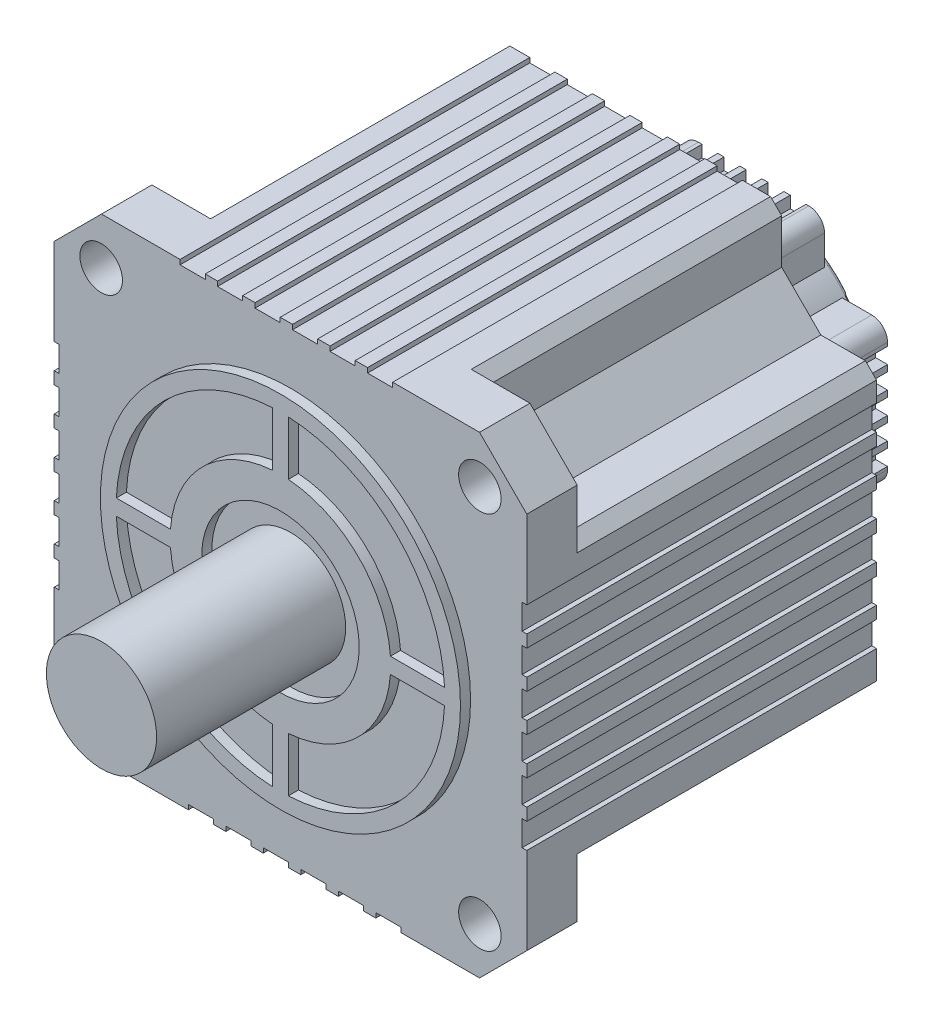
from build123d import *
from build123d.topology import SkipClean

# Parameters (mm, degrees)
EXTRUDE_1_DEPTH                     = 16
SKETCH_5_R                          = 57.15
EXTRUDE_2_DEPTH                     = 3.2
SKETCH_6_R                          = 52.15
CUT_EXTRUDE_3_DEPTH                 = 3.2
SKETCH_7_R                          = 17.5
EXTRUDE_4_DEPTH                     = 60
SKETCH_9_W                          = 29.28796894
SKETCH_9_H                          = 5
EXTRUDE_5_DEPTH                     = 3.2
PATTERN_CIRCULAR_1_COUNT            = 4
SKETCH_10_R                         = 35
SKETCH_10_R_2                       = 25
EXTRUDE_6_DEPTH                     = 3.2
EXTRUDE_7_DEPTH                     = 95
EXTRUDE_8_DEPTH                     = 36
SKETCH_13_R                         = 36.003209025
EXTRUDE_9_DEPTH                     = 2
FILLET_5_R                          = 1
SKETCH_14_W                         = 8
SKETCH_14_H                         = 13.851219487
CUT_EXTRUDE_10_DEPTH                = 120
SKETCH_15_W                         = 5
SKETCH_15_H                         = 4.986387051
CUT_EXTRUDE_11_DEPTH                = 44
PATTERN_LINEAR_4_COUNT              = 5
PATTERN_LINEAR_4_PITCH              = 7
EXTRUDE_12_DEPTH                    = 2
SKETCH_16_3_R                       = 1.5
EXTRUDE_13_DEPTH                    = 2
PATTERN_LINEAR_3_COUNT              = 6
PATTERN_LINEAR_3_PITCH              = 11.9
PATTERN_CIRCULAR_2_COUNT            = 4
PATTERN_CIRCULAR_2_COPY_1_SKETCH_W  = 8
PATTERN_CIRCULAR_2_COPY_1_SKETCH_H  = 13.851219487
PATTERN_CIRCULAR_2_COPY_1_DEPTH     = 120
PATTERN_CIRCULAR_2_COPY_2_SKETCH_W  = 8
PATTERN_CIRCULAR_2_COPY_2_SKETCH_H  = 13.851219487
PATTERN_CIRCULAR_2_COPY_2_DEPTH     = 120
PATTERN_CIRCULAR_2_COPY_3_SKETCH_W  = 8
PATTERN_CIRCULAR_2_COPY_3_SKETCH_H  = 13.851219487
PATTERN_CIRCULAR_2_COPY_3_DEPTH     = 120
PATTERN_CIRCULAR_2_COPY_4_SKETCH_W  = 8
PATTERN_CIRCULAR_2_COPY_4_SKETCH_H  = 13.851219487
PATTERN_CIRCULAR_2_COPY_4_DEPTH     = 120
PATTERN_CIRCULAR_2_COPY_5_SKETCH_W  = 8
PATTERN_CIRCULAR_2_COPY_5_SKETCH_H  = 13.851219487
PATTERN_CIRCULAR_2_COPY_5_DEPTH     = 120
PATTERN_CIRCULAR_2_COPY_6_SKETCH_W  = 8
PATTERN_CIRCULAR_2_COPY_6_SKETCH_H  = 13.851219487
PATTERN_CIRCULAR_2_COPY_6_DEPTH     = 120
PATTERN_CIRCULAR_2_COPY_7_SKETCH_W  = 8
PATTERN_CIRCULAR_2_COPY_7_SKETCH_H  = 13.851219487
PATTERN_CIRCULAR_2_COPY_7_DEPTH     = 120
PATTERN_CIRCULAR_2_COPY_8_SKETCH_W  = 8
PATTERN_CIRCULAR_2_COPY_8_SKETCH_H  = 13.851219487
PATTERN_CIRCULAR_2_COPY_8_DEPTH     = 120
PATTERN_CIRCULAR_2_COPY_9_SKETCH_W  = 8
PATTERN_CIRCULAR_2_COPY_9_SKETCH_H  = 13.851219487
PATTERN_CIRCULAR_2_COPY_9_DEPTH     = 120
PATTERN_CIRCULAR_2_COPY_10_SKETCH_W = 8
PATTERN_CIRCULAR_2_COPY_10_SKETCH_H = 13.851219487
PATTERN_CIRCULAR_2_COPY_10_DEPTH    = 120
PATTERN_CIRCULAR_2_COPY_11_SKETCH_W = 8
PATTERN_CIRCULAR_2_COPY_11_SKETCH_H = 13.851219487
PATTERN_CIRCULAR_2_COPY_11_DEPTH    = 120
PATTERN_CIRCULAR_2_COPY_12_SKETCH_W = 8
PATTERN_CIRCULAR_2_COPY_12_SKETCH_H = 13.851219487
PATTERN_CIRCULAR_2_COPY_12_DEPTH    = 120
PATTERN_CIRCULAR_2_COPY_13_SKETCH_W = 8
PATTERN_CIRCULAR_2_COPY_13_SKETCH_H = 13.851219487
PATTERN_CIRCULAR_2_COPY_13_DEPTH    = 120
PATTERN_CIRCULAR_2_COPY_14_SKETCH_W = 8
PATTERN_CIRCULAR_2_COPY_14_SKETCH_H = 13.851219487
PATTERN_CIRCULAR_2_COPY_14_DEPTH    = 120
PATTERN_CIRCULAR_2_COPY_15_SKETCH_W = 8
PATTERN_CIRCULAR_2_COPY_15_SKETCH_H = 13.851219487
PATTERN_CIRCULAR_2_COPY_15_DEPTH    = 120
PATTERN_CIRCULAR_3_COUNT            = 4
PATTERN_CIRCULAR_3_COPY_1_SKETCH_W  = 5
PATTERN_CIRCULAR_3_COPY_1_SKETCH_H  = 4.986387051
PATTERN_CIRCULAR_3_COPY_1_DEPTH     = 44
PATTERN_CIRCULAR_3_COPY_2_SKETCH_W  = 5
PATTERN_CIRCULAR_3_COPY_2_SKETCH_H  = 4.986387051
PATTERN_CIRCULAR_3_COPY_2_DEPTH     = 44
PATTERN_CIRCULAR_3_COPY_3_SKETCH_W  = 5
PATTERN_CIRCULAR_3_COPY_3_SKETCH_H  = 4.986387051
PATTERN_CIRCULAR_3_COPY_3_DEPTH     = 44
PATTERN_CIRCULAR_3_COPY_4_SKETCH_W  = 5
PATTERN_CIRCULAR_3_COPY_4_SKETCH_H  = 4.986387051
PATTERN_CIRCULAR_3_COPY_4_DEPTH     = 44
PATTERN_CIRCULAR_3_COPY_5_SKETCH_W  = 5
PATTERN_CIRCULAR_3_COPY_5_SKETCH_H  = 4.986387051
PATTERN_CIRCULAR_3_COPY_5_DEPTH     = 44
PATTERN_CIRCULAR_3_COPY_6_SKETCH_W  = 5
PATTERN_CIRCULAR_3_COPY_6_SKETCH_H  = 4.986387051
PATTERN_CIRCULAR_3_COPY_6_DEPTH     = 44
PATTERN_CIRCULAR_3_COPY_7_SKETCH_W  = 5
PATTERN_CIRCULAR_3_COPY_7_SKETCH_H  = 4.986387051
PATTERN_CIRCULAR_3_COPY_7_DEPTH     = 44
PATTERN_CIRCULAR_3_COPY_8_SKETCH_W  = 5
PATTERN_CIRCULAR_3_COPY_8_SKETCH_H  = 4.986387051
PATTERN_CIRCULAR_3_COPY_8_DEPTH     = 44
PATTERN_CIRCULAR_3_COPY_9_SKETCH_W  = 5
PATTERN_CIRCULAR_3_COPY_9_SKETCH_H  = 4.986387051
PATTERN_CIRCULAR_3_COPY_9_DEPTH     = 44
PATTERN_CIRCULAR_3_COPY_10_SKETCH_W = 5
PATTERN_CIRCULAR_3_COPY_10_SKETCH_H = 4.986387051
PATTERN_CIRCULAR_3_COPY_10_DEPTH    = 44
PATTERN_CIRCULAR_3_COPY_11_SKETCH_W = 5
PATTERN_CIRCULAR_3_COPY_11_SKETCH_H = 4.986387051
PATTERN_CIRCULAR_3_COPY_11_DEPTH    = 44
PATTERN_CIRCULAR_3_COPY_12_SKETCH_W = 5
PATTERN_CIRCULAR_3_COPY_12_SKETCH_H = 4.986387051
PATTERN_CIRCULAR_3_COPY_12_DEPTH    = 44
SKETCH_17_R                         = 6.75
CUT_EXTRUDE_15_DEPTH                = 30


with BuildPart() as part:
    # 草图1 → 拉伸1 (new body)
    with BuildSketch(Plane.XY):
        Polygon((-60, 75), (-75, 60), (-75, -60), (-60, -75), (60, -75), (75, -60), (75, 60), (60, 75), align=None)
    extrude(amount=EXTRUDE_1_DEPTH)

    # 草图5 → 拉伸2 (add)
    with BuildSketch(Plane.XY.offset(16)):
        Circle(SKETCH_5_R)
    extrude(amount=EXTRUDE_2_DEPTH)

    # 草图6 → 拉伸3 (cut)
    with BuildSketch(Plane.XY.offset(19.2)):
        Circle(SKETCH_6_R)
    extrude(amount=-CUT_EXTRUDE_3_DEPTH, mode=Mode.SUBTRACT)

    # 草图7 → 拉伸4 (add)
    with BuildSketch(Plane.XY.offset(16)):
        Circle(SKETCH_7_R)
    extrude(amount=EXTRUDE_4_DEPTH)

    # 草图9 → 拉伸5 (add)
    with BuildSketch(Plane.XY.offset(16)):
        with Locations((39.721687474, 0)):
            Rectangle(SKETCH_9_W, SKETCH_9_H)
    extrude_5 = extrude(amount=EXTRUDE_5_DEPTH)

    # 阵列(圆周)1: 拉伸5 ×4 about axis
    pattern_circular_1_axis = Axis((0, 0, 0), (0, 0, 1))
    for i in range(1, PATTERN_CIRCULAR_1_COUNT):
        add(extrude_5.rotate(pattern_circular_1_axis, i * 360 / PATTERN_CIRCULAR_1_COUNT))

    # 草图10 → 拉伸6 (add)
    with BuildSketch(Plane.XY.offset(16)):
        Circle(SKETCH_10_R)
        Circle(SKETCH_10_R_2, mode=Mode.SUBTRACT)
    extrude(amount=EXTRUDE_6_DEPTH)

    # 草图11 → 拉伸7 (add)
    with BuildSketch(Plane(origin=(0, 0, 0), x_dir=(-1, 0, 0), z_dir=(0, 0, -1))):
        Polygon((-75, 41.375735931), (-75, 11.872226679), (-75, -41.375735931), (-71.464466094, -44.911269837), (-57.32233047, -44.911269837), (-44.911269837, -57.32233047), (-44.911269837, -71.464466094), (-41.375735931, -75), (-11.872226679, -75), (41.375735931, -75), (44.911269837, -71.464466094), (44.911269837, -57.32233047), (57.32233047, -44.911269837), (71.464466094, -44.911269837), (75, -41.375735931), (75, -11.872226679), (75, 41.375735931), (71.464466094, 44.911269837), (57.32233047, 44.911269837), (44.911269837, 57.32233047), (44.911269837, 71.464466094), (41.375735931, 75), (11.872226679, 75), (-41.375735931, 75), (-44.911269837, 71.464466094), (-44.911269837, 57.32233047), (-57.32233047, 44.911269837), (-71.464466094, 44.911269837), align=None)
    extrude(amount=EXTRUDE_7_DEPTH)

    # 草图12 → 拉伸8 (add)
    with BuildSketch(Plane(origin=(0, 0, -95), x_dir=(-1, 0, 0), z_dir=(0, 0, -1))):
        with BuildLine():
            Line((-42.5, -17.5), (-42.5, 17.5))
            ThreePointArc((-42.5, 17.5), (-41.035533906, 21.035533906), (-37.5, 22.5))
            Line((-37.5, 22.5), (-28.106601718, 22.5))
            ThreePointArc((-28.106601718, 22.5), (-25.458113246, 25.458113246), (-22.5, 28.106601718))
            Line((-22.5, 28.106601718), (-22.5, 37.496601718))
            ThreePointArc((-22.5, 37.496601718), (-21.035533906, 41.032135624), (-17.5, 42.496601718))
            Line((-17.5, 42.496601718), (17.5, 42.496601718))
            ThreePointArc((17.5, 42.496601718), (21.035533906, 41.032135624), (22.5, 37.496601718))
            Line((22.5, 37.496601718), (22.5, 28.106601718))
            ThreePointArc((22.5, 28.106601718), (25.458113246, 25.458113246), (28.106601718, 22.5))
            Line((28.106601718, 22.5), (37.5, 22.5))
            ThreePointArc((37.5, 22.5), (41.035533906, 21.035533906), (42.5, 17.5))
            Line((42.5, 17.5), (42.5, -17.5))
            ThreePointArc((42.5, -17.5), (41.035533906, -21.035533906), (37.5, -22.5))
            Line((37.5, -22.5), (28.106601718, -22.5))
            ThreePointArc((28.106601718, -22.5), (25.458113246, -25.458113246), (22.5, -28.106601718))
            Line((22.5, -28.106601718), (22.5, -37.5))
            ThreePointArc((22.5, -37.5), (21.035533906, -41.035533906), (17.5, -42.5))
            Line((17.5, -42.5), (-17.5, -42.5))
            ThreePointArc((-17.5, -42.5), (-21.035533906, -41.035533906), (-22.5, -37.5))
            Line((-22.5, -37.5), (-22.5, -28.106601718))
            ThreePointArc((-22.5, -28.106601718), (-25.458113246, -25.458113246), (-28.106601718, -22.5))
            Line((-28.106601718, -22.5), (-37.5, -22.5))
            ThreePointArc((-37.5, -22.5), (-41.035533906, -21.035533906), (-42.5, -17.5))
        make_face()
    extrude(amount=EXTRUDE_8_DEPTH)

    # 草图13 → 拉伸9 (add)
    with BuildSketch(Plane(origin=(0, 0, -131), x_dir=(-1, 0, 0), z_dir=(0, 0, -1))):
        with Locations(Location((0, 0, 0), (0, 0, 218.678098804))):
            Circle(SKETCH_13_R)
    extrude(amount=EXTRUDE_9_DEPTH)

    # 圆角5
    fillet_5_edges = [part.edges().sort_by_distance(p)[0] for p in [
        (-28.106601718, 22.5, -133),
    ]]
    fillet(fillet_5_edges, radius=FILLET_5_R)

    # 草图14 → 拉伸10 (cut)
    with SkipClean():  # the faces are left unmerged after this step: merging them gives an invalid solid
        with BuildSketch(Plane(origin=(0, 0, -95), x_dir=(-1, 0, 0), z_dir=(0, 0, -1))):
            with Locations((-28.437637144, 80.428126698)):
                Rectangle(SKETCH_14_W, SKETCH_14_H)
        cut_extrude_10 = extrude(amount=-CUT_EXTRUDE_10_DEPTH, mode=Mode.SUBTRACT)

    # 草图15 → 拉伸11 (cut)
    with SkipClean():  # the faces are left unmerged after this step: merging them gives an invalid solid
        with BuildSketch(Plane(origin=(0, 0, -131), x_dir=(-1, 0, 0), z_dir=(0, 0, -1))):
            with Locations((-13.879356153, -41.240442285)):
                Rectangle(SKETCH_15_W, SKETCH_15_H)
        cut_extrude_11 = extrude(amount=-CUT_EXTRUDE_11_DEPTH, mode=Mode.SUBTRACT)

    # 阵列(线性)4: 拉伸11 ×5
    with SkipClean():  # the faces are left unmerged after this step: merging them gives an invalid solid
        with Locations(*[(-i * PATTERN_LINEAR_4_PITCH, 0, 0) for i in range(1, PATTERN_LINEAR_4_COUNT)]):
            add(cut_extrude_11, mode=Mode.SUBTRACT)

    # 草图16 → 拉伸12 (add)
    with SkipClean():  # the faces are left unmerged after this step: merging them gives an invalid solid
        with BuildSketch(Plane(origin=(0, 0, -133), x_dir=(-1, 0, 0), z_dir=(0, 0, -1))):
            with BuildLine():
                Line((13.498025706, 12.925098524), (3.778424262, 12.925098524))
                Line((3.778424262, 12.925098524), (-4.48952493, 12.925098524))
                ThreePointArc((-4.48952493, 12.925098524), (-5.355550334, 12.425098524), (-5.355550334, 11.425098524))
                Line((-5.355550334, 11.425098524), (-2.087601141, 5.764844486))
                ThreePointArc((-2.087601141, 5.764844486), (-1.221575738, 5.264844486), (-0.355550334, 5.764844486))
                Line((-0.355550334, 5.764844486), (2.912398859, 11.425098524))
                ThreePointArc((2.912398859, 11.425098524), (3.778424262, 11.925098524), (4.644449666, 11.425098524))
                Line((4.644449666, 11.425098524), (7.912398859, 5.764844486))
                ThreePointArc((7.912398859, 5.764844486), (7.912398859, 4.764844486), (7.046373455, 4.264844486))
                Line((7.046373455, 4.264844486), (-9.48952493, 4.264844486))
                ThreePointArc((-9.48952493, 4.264844486), (-10.355550334, 4.764844486), (-10.355550334, 5.764844486))
                Line((-10.355550334, 5.764844486), (-2.087601141, 20.085352561))
                ThreePointArc((-2.087601141, 20.085352561), (-1.221575738, 20.585352561), (-0.355550334, 20.085352561))
                Line((-0.355550334, 20.085352561), (2.912398859, 14.425098524))
                ThreePointArc((2.912398859, 14.425098524), (3.278424262, 14.05907312), (3.778424262, 13.925098524))
                Line((3.778424262, 13.925098524), (13.266114347, 13.925098524))
                ThreePointArc((13.266114347, 13.925098524), (-16.092946745, 8.078162398), (13.778424262, 10.038347178))
                ThreePointArc((13.778424262, 10.038347178), (13.708160055, 11.488515847), (13.498025706, 12.925098524))
            make_face()
        extrude(amount=EXTRUDE_12_DEPTH)

    # 草图16<3> → 拉伸13 (add)
    with SkipClean():  # the faces are left unmerged after this step: merging them gives an invalid solid
        with BuildSketch(Plane(origin=(0, 0, -133), x_dir=(-1, 0, 0), z_dir=(0, 0, -1))):
            with BuildLine():
                Line((-9.798250078, -13.165637846), (-9.798250078, -14.565637846))
                ThreePointArc((-9.798250078, -14.565637846), (-9.886118043, -14.77776988), (-10.098250078, -14.865637846))
                Line((-10.098250078, -14.865637846), (-12.798250078, -14.865637846))
                Line((-12.798250078, -14.865637846), (-12.798250078, -10.865637846))
                Line((-12.798250078, -10.865637846), (-6.798250078, -10.865637846))
                Line((-6.798250078, -10.865637846), (-6.798250078, -9.865637846))
                Line((-6.798250078, -9.865637846), (-14.798250078, -9.865637846))
                ThreePointArc((-14.798250078, -9.865637846), (-15.505356859, -10.158531065), (-15.798250078, -10.865637846))
                Line((-15.798250078, -10.865637846), (-15.798250078, -14.865637846))
                ThreePointArc((-15.798250078, -14.865637846), (-15.505356859, -15.572744627), (-14.798250078, -15.865637846))
                Line((-14.798250078, -15.865637846), (-6.798250078, -15.865637846))
                Line((-6.798250078, -15.865637846), (-6.798250078, -11.790340586))
                Line((-6.798250078, -11.790340586), (-10.798250078, -11.790340586))
                Line((-10.798250078, -11.790340586), (-10.798250078, -12.865637846))
                Line((-10.798250078, -12.865637846), (-10.098250078, -12.865637846))
                ThreePointArc((-10.098250078, -12.865637846), (-9.886118043, -12.953505811), (-9.798250078, -13.165637846))
            make_face()
            with BuildLine():
                ThreePointArc((0.434140924, -14.749084196), (0.646272958, -14.661216231), (0.734140924, -14.449084196))
                Line((0.734140924, -14.449084196), (0.734140924, -14.165637846))
                ThreePointArc((0.734140924, -14.165637846), (0.646272958, -13.953505811), (0.434140924, -13.865637846))
                Line((0.434140924, -13.865637846), (-4.265859076, -13.865637846))
                ThreePointArc((-4.265859076, -13.865637846), (-4.972965857, -13.572744627), (-5.265859076, -12.865637846))
                Line((-5.265859076, -12.865637846), (-5.265859076, -10.865637846))
                ThreePointArc((-5.265859076, -10.865637846), (-4.972965857, -10.158531065), (-4.265859076, -9.865637846))
                Line((-4.265859076, -9.865637846), (3.734140924, -9.865637846))
                Line((3.734140924, -9.865637846), (3.734140924, -10.865637846))
                Line((3.734140924, -10.865637846), (-1.965859076, -10.865637846))
                ThreePointArc((-1.965859076, -10.865637846), (-2.17799111, -10.953505811), (-2.265859076, -11.165637846))
                Line((-2.265859076, -11.165637846), (-2.265859076, -11.565637846))
                ThreePointArc((-2.265859076, -11.565637846), (-2.17799111, -11.77776988), (-1.965859076, -11.865637846))
                Line((-1.965859076, -11.865637846), (2.734140924, -11.865637846))
                ThreePointArc((2.734140924, -11.865637846), (3.441247705, -12.158531065), (3.734140924, -12.865637846))
                Line((3.734140924, -12.865637846), (3.734140924, -14.865637846))
                ThreePointArc((3.734140924, -14.865637846), (3.441247705, -15.572744627), (2.734140924, -15.865637846))
                Line((2.734140924, -15.865637846), (-5.265859076, -15.865637846))
                Line((-5.265859076, -15.865637846), (-5.265859076, -14.749084196))
                Line((-5.265859076, -14.749084196), (0.434140924, -14.749084196))
            make_face()
            Polygon((6.120189581, -9.865637846), (6.120189581, -15.865637846), (9.120189581, -15.865637846), (9.120189581, -14.365637846), (11.691618152, -15.865637846), (15.120189581, -15.865637846), (9.120189581, -12.365637846), (9.120189581, -9.865637846), align=None)
            with Locations((12.244660914, -11.202039893)):
                Circle(SKETCH_16_3_R)
        extrude(amount=EXTRUDE_13_DEPTH)

    # 阵列(线性)3: 拉伸10 ×6
    with SkipClean():  # the faces are left unmerged after this step: merging them gives an invalid solid
        with Locations(*[(-i * PATTERN_LINEAR_3_PITCH, 0, 0) for i in range(1, PATTERN_LINEAR_3_COUNT)]):
            add(cut_extrude_10, mode=Mode.SUBTRACT)

    # 阵列(圆周)2: 拉伸10 ×4 about axis
    with SkipClean():  # the faces are left unmerged after this step: merging them gives an invalid solid
        pattern_circular_2_axis = Axis((0, 0, 0), (0, 0, 1))
        for i in range(1, PATTERN_CIRCULAR_2_COUNT):
            add(cut_extrude_10.rotate(pattern_circular_2_axis, i * 360 / PATTERN_CIRCULAR_2_COUNT), mode=Mode.SUBTRACT)

    # 阵列(圆周)2 copy 1 sketch → 阵列(圆周)2 copy 1 (cut)
    with SkipClean():  # the faces are left unmerged after this step: merging them gives an invalid solid
        with BuildSketch(Plane(origin=(0, -11.9, -95), x_dir=(0, -1, 0), z_dir=(0, 0, -1))):
            with Locations((-28.437637144, 80.428126698)):
                Rectangle(PATTERN_CIRCULAR_2_COPY_1_SKETCH_W, PATTERN_CIRCULAR_2_COPY_1_SKETCH_H)
        extrude(amount=-PATTERN_CIRCULAR_2_COPY_1_DEPTH, mode=Mode.SUBTRACT)

    # 阵列(圆周)2 copy 2 sketch → 阵列(圆周)2 copy 2 (cut)
    with SkipClean():  # the faces are left unmerged after this step: merging them gives an invalid solid
        with BuildSketch(Plane(origin=(11.9, 0, -95), x_dir=(1, 0, 0), z_dir=(0, 0, -1))):
            with Locations((-28.437637144, 80.428126698)):
                Rectangle(PATTERN_CIRCULAR_2_COPY_2_SKETCH_W, PATTERN_CIRCULAR_2_COPY_2_SKETCH_H)
        extrude(amount=-PATTERN_CIRCULAR_2_COPY_2_DEPTH, mode=Mode.SUBTRACT)

    # 阵列(圆周)2 copy 3 sketch → 阵列(圆周)2 copy 3 (cut)
    with SkipClean():  # the faces are left unmerged after this step: merging them gives an invalid solid
        with BuildSketch(Plane(origin=(0, 11.9, -95), x_dir=(0, 1, 0), z_dir=(0, 0, -1))):
            with Locations((-28.437637144, 80.428126698)):
                Rectangle(PATTERN_CIRCULAR_2_COPY_3_SKETCH_W, PATTERN_CIRCULAR_2_COPY_3_SKETCH_H)
        extrude(amount=-PATTERN_CIRCULAR_2_COPY_3_DEPTH, mode=Mode.SUBTRACT)

    # 阵列(圆周)2 copy 4 sketch → 阵列(圆周)2 copy 4 (cut)
    with SkipClean():  # the faces are left unmerged after this step: merging them gives an invalid solid
        with BuildSketch(Plane(origin=(0, -23.8, -95), x_dir=(0, -1, 0), z_dir=(0, 0, -1))):
            with Locations((-28.437637144, 80.428126698)):
                Rectangle(PATTERN_CIRCULAR_2_COPY_4_SKETCH_W, PATTERN_CIRCULAR_2_COPY_4_SKETCH_H)
        extrude(amount=-PATTERN_CIRCULAR_2_COPY_4_DEPTH, mode=Mode.SUBTRACT)

    # 阵列(圆周)2 copy 5 sketch → 阵列(圆周)2 copy 5 (cut)
    with SkipClean():  # the faces are left unmerged after this step: merging them gives an invalid solid
        with BuildSketch(Plane(origin=(23.8, 0, -95), x_dir=(1, 0, 0), z_dir=(0, 0, -1))):
            with Locations((-28.437637144, 80.428126698)):
                Rectangle(PATTERN_CIRCULAR_2_COPY_5_SKETCH_W, PATTERN_CIRCULAR_2_COPY_5_SKETCH_H)
        extrude(amount=-PATTERN_CIRCULAR_2_COPY_5_DEPTH, mode=Mode.SUBTRACT)

    # 阵列(圆周)2 copy 6 sketch → 阵列(圆周)2 copy 6 (cut)
    with SkipClean():  # the faces are left unmerged after this step: merging them gives an invalid solid
        with BuildSketch(Plane(origin=(0, 23.8, -95), x_dir=(0, 1, 0), z_dir=(0, 0, -1))):
            with Locations((-28.437637144, 80.428126698)):
                Rectangle(PATTERN_CIRCULAR_2_COPY_6_SKETCH_W, PATTERN_CIRCULAR_2_COPY_6_SKETCH_H)
        extrude(amount=-PATTERN_CIRCULAR_2_COPY_6_DEPTH, mode=Mode.SUBTRACT)

    # 阵列(圆周)2 copy 7 sketch → 阵列(圆周)2 copy 7 (cut)
    with SkipClean():  # the faces are left unmerged after this step: merging them gives an invalid solid
        with BuildSketch(Plane(origin=(0, -35.7, -95), x_dir=(0, -1, 0), z_dir=(0, 0, -1))):
            with Locations((-28.437637144, 80.428126698)):
                Rectangle(PATTERN_CIRCULAR_2_COPY_7_SKETCH_W, PATTERN_CIRCULAR_2_COPY_7_SKETCH_H)
        extrude(amount=-PATTERN_CIRCULAR_2_COPY_7_DEPTH, mode=Mode.SUBTRACT)

    # 阵列(圆周)2 copy 8 sketch → 阵列(圆周)2 copy 8 (cut)
    with SkipClean():  # the faces are left unmerged after this step: merging them gives an invalid solid
        with BuildSketch(Plane(origin=(35.7, 0, -95), x_dir=(1, 0, 0), z_dir=(0, 0, -1))):
            with Locations((-28.437637144, 80.428126698)):
                Rectangle(PATTERN_CIRCULAR_2_COPY_8_SKETCH_W, PATTERN_CIRCULAR_2_COPY_8_SKETCH_H)
        extrude(amount=-PATTERN_CIRCULAR_2_COPY_8_DEPTH, mode=Mode.SUBTRACT)

    # 阵列(圆周)2 copy 9 sketch → 阵列(圆周)2 copy 9 (cut)
    with SkipClean():  # the faces are left unmerged after this step: merging them gives an invalid solid
        with BuildSketch(Plane(origin=(0, 35.7, -95), x_dir=(0, 1, 0), z_dir=(0, 0, -1))):
            with Locations((-28.437637144, 80.428126698)):
                Rectangle(PATTERN_CIRCULAR_2_COPY_9_SKETCH_W, PATTERN_CIRCULAR_2_COPY_9_SKETCH_H)
        extrude(amount=-PATTERN_CIRCULAR_2_COPY_9_DEPTH, mode=Mode.SUBTRACT)

    # 阵列(圆周)2 copy 10 sketch → 阵列(圆周)2 copy 10 (cut)
    with SkipClean():  # the faces are left unmerged after this step: merging them gives an invalid solid
        with BuildSketch(Plane(origin=(0, -47.6, -95), x_dir=(0, -1, 0), z_dir=(0, 0, -1))):
            with Locations((-28.437637144, 80.428126698)):
                Rectangle(PATTERN_CIRCULAR_2_COPY_10_SKETCH_W, PATTERN_CIRCULAR_2_COPY_10_SKETCH_H)
        extrude(amount=-PATTERN_CIRCULAR_2_COPY_10_DEPTH, mode=Mode.SUBTRACT)

    # 阵列(圆周)2 copy 11 sketch → 阵列(圆周)2 copy 11 (cut)
    with SkipClean():  # the faces are left unmerged after this step: merging them gives an invalid solid
        with BuildSketch(Plane(origin=(47.6, 0, -95), x_dir=(1, 0, 0), z_dir=(0, 0, -1))):
            with Locations((-28.437637144, 80.428126698)):
                Rectangle(PATTERN_CIRCULAR_2_COPY_11_SKETCH_W, PATTERN_CIRCULAR_2_COPY_11_SKETCH_H)
        extrude(amount=-PATTERN_CIRCULAR_2_COPY_11_DEPTH, mode=Mode.SUBTRACT)

    # 阵列(圆周)2 copy 12 sketch → 阵列(圆周)2 copy 12 (cut)
    with SkipClean():  # the faces are left unmerged after this step: merging them gives an invalid solid
        with BuildSketch(Plane(origin=(0, 47.6, -95), x_dir=(0, 1, 0), z_dir=(0, 0, -1))):
            with Locations((-28.437637144, 80.428126698)):
                Rectangle(PATTERN_CIRCULAR_2_COPY_12_SKETCH_W, PATTERN_CIRCULAR_2_COPY_12_SKETCH_H)
        extrude(amount=-PATTERN_CIRCULAR_2_COPY_12_DEPTH, mode=Mode.SUBTRACT)

    # 阵列(圆周)2 copy 13 sketch → 阵列(圆周)2 copy 13 (cut)
    with SkipClean():  # the faces are left unmerged after this step: merging them gives an invalid solid
        with BuildSketch(Plane(origin=(0, -59.5, -95), x_dir=(0, -1, 0), z_dir=(0, 0, -1))):
            with Locations((-28.437637144, 80.428126698)):
                Rectangle(PATTERN_CIRCULAR_2_COPY_13_SKETCH_W, PATTERN_CIRCULAR_2_COPY_13_SKETCH_H)
        extrude(amount=-PATTERN_CIRCULAR_2_COPY_13_DEPTH, mode=Mode.SUBTRACT)

    # 阵列(圆周)2 copy 14 sketch → 阵列(圆周)2 copy 14 (cut)
    with SkipClean():  # the faces are left unmerged after this step: merging them gives an invalid solid
        with BuildSketch(Plane(origin=(59.5, 0, -95), x_dir=(1, 0, 0), z_dir=(0, 0, -1))):
            with Locations((-28.437637144, 80.428126698)):
                Rectangle(PATTERN_CIRCULAR_2_COPY_14_SKETCH_W, PATTERN_CIRCULAR_2_COPY_14_SKETCH_H)
        extrude(amount=-PATTERN_CIRCULAR_2_COPY_14_DEPTH, mode=Mode.SUBTRACT)

    # 阵列(圆周)2 copy 15 sketch → 阵列(圆周)2 copy 15 (cut)
    with SkipClean():  # the faces are left unmerged after this step: merging them gives an invalid solid
        with BuildSketch(Plane(origin=(0, 59.5, -95), x_dir=(0, 1, 0), z_dir=(0, 0, -1))):
            with Locations((-28.437637144, 80.428126698)):
                Rectangle(PATTERN_CIRCULAR_2_COPY_15_SKETCH_W, PATTERN_CIRCULAR_2_COPY_15_SKETCH_H)
        extrude(amount=-PATTERN_CIRCULAR_2_COPY_15_DEPTH, mode=Mode.SUBTRACT)

    # 阵列(圆周)3: 拉伸11 ×4 about axis
    with SkipClean():  # the faces are left unmerged after this step: merging them gives an invalid solid
        pattern_circular_3_axis = Axis((0, 0, 0), (0, 0, 1))
        for i in range(1, PATTERN_CIRCULAR_3_COUNT):
            add(cut_extrude_11.rotate(pattern_circular_3_axis, i * 360 / PATTERN_CIRCULAR_3_COUNT), mode=Mode.SUBTRACT)

    # 阵列(圆周)3 copy 1 sketch → 阵列(圆周)3 copy 1 (cut)
    with SkipClean():  # the faces are left unmerged after this step: merging them gives an invalid solid
        with BuildSketch(Plane(origin=(0, -7, -131), x_dir=(0, -1, 0), z_dir=(0, 0, -1))):
            with Locations((-13.879356153, -41.240442285)):
                Rectangle(PATTERN_CIRCULAR_3_COPY_1_SKETCH_W, PATTERN_CIRCULAR_3_COPY_1_SKETCH_H)
        extrude(amount=-PATTERN_CIRCULAR_3_COPY_1_DEPTH, mode=Mode.SUBTRACT)

    # 阵列(圆周)3 copy 2 sketch → 阵列(圆周)3 copy 2 (cut)
    with SkipClean():  # the faces are left unmerged after this step: merging them gives an invalid solid
        with BuildSketch(Plane(origin=(7, 0, -131), x_dir=(1, 0, 0), z_dir=(0, 0, -1))):
            with Locations((-13.879356153, -41.240442285)):
                Rectangle(PATTERN_CIRCULAR_3_COPY_2_SKETCH_W, PATTERN_CIRCULAR_3_COPY_2_SKETCH_H)
        extrude(amount=-PATTERN_CIRCULAR_3_COPY_2_DEPTH, mode=Mode.SUBTRACT)

    # 阵列(圆周)3 copy 3 sketch → 阵列(圆周)3 copy 3 (cut)
    with SkipClean():  # the faces are left unmerged after this step: merging them gives an invalid solid
        with BuildSketch(Plane(origin=(0, 7, -131), x_dir=(0, 1, 0), z_dir=(0, 0, -1))):
            with Locations((-13.879356153, -41.240442285)):
                Rectangle(PATTERN_CIRCULAR_3_COPY_3_SKETCH_W, PATTERN_CIRCULAR_3_COPY_3_SKETCH_H)
        extrude(amount=-PATTERN_CIRCULAR_3_COPY_3_DEPTH, mode=Mode.SUBTRACT)

    # 阵列(圆周)3 copy 4 sketch → 阵列(圆周)3 copy 4 (cut)
    with SkipClean():  # the faces are left unmerged after this step: merging them gives an invalid solid
        with BuildSketch(Plane(origin=(0, -14, -131), x_dir=(0, -1, 0), z_dir=(0, 0, -1))):
            with Locations((-13.879356153, -41.240442285)):
                Rectangle(PATTERN_CIRCULAR_3_COPY_4_SKETCH_W, PATTERN_CIRCULAR_3_COPY_4_SKETCH_H)
        extrude(amount=-PATTERN_CIRCULAR_3_COPY_4_DEPTH, mode=Mode.SUBTRACT)

    # 阵列(圆周)3 copy 5 sketch → 阵列(圆周)3 copy 5 (cut)
    with SkipClean():  # the faces are left unmerged after this step: merging them gives an invalid solid
        with BuildSketch(Plane(origin=(14, 0, -131), x_dir=(1, 0, 0), z_dir=(0, 0, -1))):
            with Locations((-13.879356153, -41.240442285)):
                Rectangle(PATTERN_CIRCULAR_3_COPY_5_SKETCH_W, PATTERN_CIRCULAR_3_COPY_5_SKETCH_H)
        extrude(amount=-PATTERN_CIRCULAR_3_COPY_5_DEPTH, mode=Mode.SUBTRACT)

    # 阵列(圆周)3 copy 6 sketch → 阵列(圆周)3 copy 6 (cut)
    with SkipClean():  # the faces are left unmerged after this step: merging them gives an invalid solid
        with BuildSketch(Plane(origin=(0, 14, -131), x_dir=(0, 1, 0), z_dir=(0, 0, -1))):
            with Locations((-13.879356153, -41.240442285)):
                Rectangle(PATTERN_CIRCULAR_3_COPY_6_SKETCH_W, PATTERN_CIRCULAR_3_COPY_6_SKETCH_H)
        extrude(amount=-PATTERN_CIRCULAR_3_COPY_6_DEPTH, mode=Mode.SUBTRACT)

    # 阵列(圆周)3 copy 7 sketch → 阵列(圆周)3 copy 7 (cut)
    with SkipClean():  # the faces are left unmerged after this step: merging them gives an invalid solid
        with BuildSketch(Plane(origin=(0, -21, -131), x_dir=(0, -1, 0), z_dir=(0, 0, -1))):
            with Locations((-13.879356153, -41.240442285)):
                Rectangle(PATTERN_CIRCULAR_3_COPY_7_SKETCH_W, PATTERN_CIRCULAR_3_COPY_7_SKETCH_H)
        extrude(amount=-PATTERN_CIRCULAR_3_COPY_7_DEPTH, mode=Mode.SUBTRACT)

    # 阵列(圆周)3 copy 8 sketch → 阵列(圆周)3 copy 8 (cut)
    with SkipClean():  # the faces are left unmerged after this step: merging them gives an invalid solid
        with BuildSketch(Plane(origin=(21, 0, -131), x_dir=(1, 0, 0), z_dir=(0, 0, -1))):
            with Locations((-13.879356153, -41.240442285)):
                Rectangle(PATTERN_CIRCULAR_3_COPY_8_SKETCH_W, PATTERN_CIRCULAR_3_COPY_8_SKETCH_H)
        extrude(amount=-PATTERN_CIRCULAR_3_COPY_8_DEPTH, mode=Mode.SUBTRACT)

    # 阵列(圆周)3 copy 9 sketch → 阵列(圆周)3 copy 9 (cut)
    with SkipClean():  # the faces are left unmerged after this step: merging them gives an invalid solid
        with BuildSketch(Plane(origin=(0, 21, -131), x_dir=(0, 1, 0), z_dir=(0, 0, -1))):
            with Locations((-13.879356153, -41.240442285)):
                Rectangle(PATTERN_CIRCULAR_3_COPY_9_SKETCH_W, PATTERN_CIRCULAR_3_COPY_9_SKETCH_H)
        extrude(amount=-PATTERN_CIRCULAR_3_COPY_9_DEPTH, mode=Mode.SUBTRACT)

    # 阵列(圆周)3 copy 10 sketch → 阵列(圆周)3 copy 10 (cut)
    with SkipClean():  # the faces are left unmerged after this step: merging them gives an invalid solid
        with BuildSketch(Plane(origin=(0, -28, -131), x_dir=(0, -1, 0), z_dir=(0, 0, -1))):
            with Locations((-13.879356153, -41.240442285)):
                Rectangle(PATTERN_CIRCULAR_3_COPY_10_SKETCH_W, PATTERN_CIRCULAR_3_COPY_10_SKETCH_H)
        extrude(amount=-PATTERN_CIRCULAR_3_COPY_10_DEPTH, mode=Mode.SUBTRACT)

    # 阵列(圆周)3 copy 11 sketch → 阵列(圆周)3 copy 11 (cut)
    with SkipClean():  # the faces are left unmerged after this step: merging them gives an invalid solid
        with BuildSketch(Plane(origin=(28, 0, -131), x_dir=(1, 0, 0), z_dir=(0, 0, -1))):
            with Locations((-13.879356153, -41.240442285)):
                Rectangle(PATTERN_CIRCULAR_3_COPY_11_SKETCH_W, PATTERN_CIRCULAR_3_COPY_11_SKETCH_H)
        extrude(amount=-PATTERN_CIRCULAR_3_COPY_11_DEPTH, mode=Mode.SUBTRACT)

    # 阵列(圆周)3 copy 12 sketch → 阵列(圆周)3 copy 12 (cut)
    with SkipClean():  # the faces are left unmerged after this step: merging them gives an invalid solid
        with BuildSketch(Plane(origin=(0, 28, -131), x_dir=(0, 1, 0), z_dir=(0, 0, -1))):
            with Locations((-13.879356153, -41.240442285)):
                Rectangle(PATTERN_CIRCULAR_3_COPY_12_SKETCH_W, PATTERN_CIRCULAR_3_COPY_12_SKETCH_H)
        extrude(amount=-PATTERN_CIRCULAR_3_COPY_12_DEPTH, mode=Mode.SUBTRACT)

    # 草图17 → 拉伸15 (cut)
    with SkipClean():  # the faces are left unmerged after this step: merging them gives an invalid solid
        with BuildSketch(Plane.XY.offset(16)):
            with Locations((-60.104076401, 60.104076401)):
                Circle(SKETCH_17_R)
            with Locations((60.104076401, 60.104076401)):
                Circle(SKETCH_17_R)
            with Locations((60.104076401, -60.104076401)):
                Circle(SKETCH_17_R)
            with Locations((-60.104076401, -60.104076401)):
                Circle(SKETCH_17_R)
        extrude(amount=-CUT_EXTRUDE_15_DEPTH, mode=Mode.SUBTRACT)


solid = part.part
